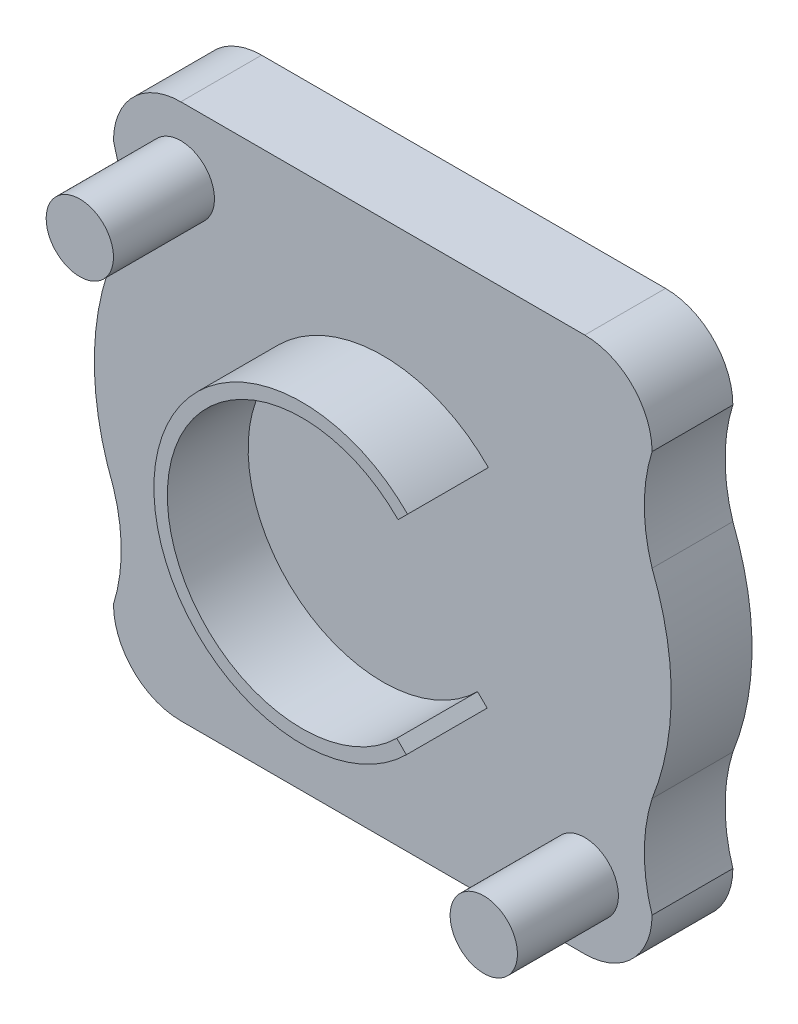
from build123d import *

# Parameters (mm, degrees)
BOSS_EXTRUDE5_DEPTH = 3.048
BOSS_EXTRUDE6_DEPTH = 3.048
PRONGS_R            = 1.27
BOSS_EXTRUDE7_DEPTH = 3.81


with BuildPart() as part:
    # Back Plate → Boss-Extrude5 (new body)
    with BuildSketch(Plane.XY):
        with BuildLine():
            Line((0, -10.16), (7.62, -10.16))
            ThreePointArc((7.62, -10.16), (9.416051224, -9.416051224), (10.16, -7.62))
            ThreePointArc((10.16, -7.62), (9.867513929, -5.715), (10.16, -3.81))
            ThreePointArc((10.16, -3.81), (10.882617987, -0.046833682), (10.16, 3.716332637))
            ThreePointArc((10.16, 3.716332637), (9.867513929, 5.621332637), (10.16, 7.526332637))
            ThreePointArc((10.16, 7.526332637), (9.416051224, 9.322383861), (7.62, 10.066332637))
            Line((7.62, 10.066332637), (-7.62, 10.066332637))
            ThreePointArc((-7.62, 10.066332637), (-9.416051224, 9.322383861), (-10.16, 7.526332637))
            ThreePointArc((-10.16, 7.526332637), (-9.867513929, 5.621332637), (-10.16, 3.716332637))
            ThreePointArc((-10.16, 3.716332637), (-10.882617987, -0.046833682), (-10.16, -3.81))
            ThreePointArc((-10.16, -3.81), (-9.867513929, -5.715), (-10.16, -7.62))
            ThreePointArc((-10.16, -7.62), (-9.416051224, -9.416051224), (-7.62, -10.16))
            Line((-7.62, -10.16), (0, -10.16))
        make_face()
    extrude(amount=-BOSS_EXTRUDE5_DEPTH)

    # Inner Circle → Boss-Extrude6 (add)
    with BuildSketch(Plane.XY):
        with BuildLine():
            Line((3.624386403, 3.559525699), (3.984498069, 3.917846237))
            ThreePointArc((3.984498069, 3.917846237), (-5.58790138, 0.033198873), (3.937664969, -3.96491344))
            Line((3.937664969, -3.96491344), (3.577553303, -3.606592902))
            ThreePointArc((3.577553303, -3.606592902), (-5.079891518, 0.033198873), (3.624386403, 3.559525699))
        make_face()
    extrude(amount=BOSS_EXTRUDE6_DEPTH)

    # Prongs → Boss-Extrude7 (add)
    with BuildSketch(Plane.XY):
        with Locations(Location((-7.62, 7.526332637, 0), (0, 0, 180))):
            Circle(PRONGS_R)
        with Locations(Location((7.62, -7.62, 0), (0, 0, 180))):
            Circle(PRONGS_R)
    extrude(amount=BOSS_EXTRUDE7_DEPTH)


solid = part.part
